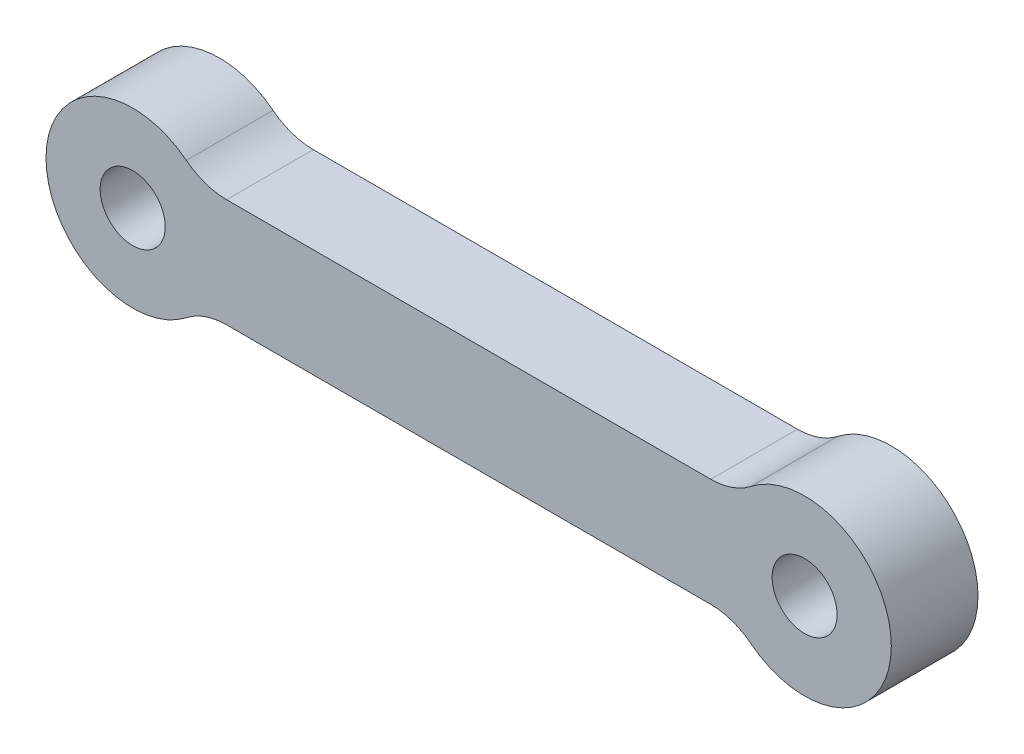
from build123d import *

# Parameters (mm, degrees)
SKETCH1_R           = 1.5
BOSS_EXTRUDE1_DEPTH = 4


with BuildPart() as part:
    # Sketch1 → Boss-Extrude1 (new body)
    with BuildSketch(Plane.XY):
        with BuildLine():
            Line((-11.169872981, -2.5), (11.169872981, -2.5))
            ThreePointArc((11.169872981, -2.5), (12.151853487, -2.665266452), (13.025641703, -3.142857143))
            ThreePointArc((13.025641703, -3.142857143), (19.5, 0), (13.025641703, 3.142857143))
            ThreePointArc((13.025641703, 3.142857143), (12.151853487, 2.665266452), (11.169872981, 2.5))
            Line((11.169872981, 2.5), (-11.169872981, 2.5))
            ThreePointArc((-11.169872981, 2.5), (-12.151853487, 2.665266452), (-13.025641703, 3.142857143))
            ThreePointArc((-13.025641703, 3.142857143), (-19.5, 0), (-13.025641703, -3.142857143))
            ThreePointArc((-13.025641703, -3.142857143), (-12.151853487, -2.665266452), (-11.169872981, -2.5))
        make_face()
        with Locations((-15.5, 0)):
            Circle(SKETCH1_R, mode=Mode.SUBTRACT)
        with Locations(Location((15.5, 0, 0), (0, 0, 180))):
            Circle(SKETCH1_R, mode=Mode.SUBTRACT)
    extrude(amount=BOSS_EXTRUDE1_DEPTH)


solid = part.part
